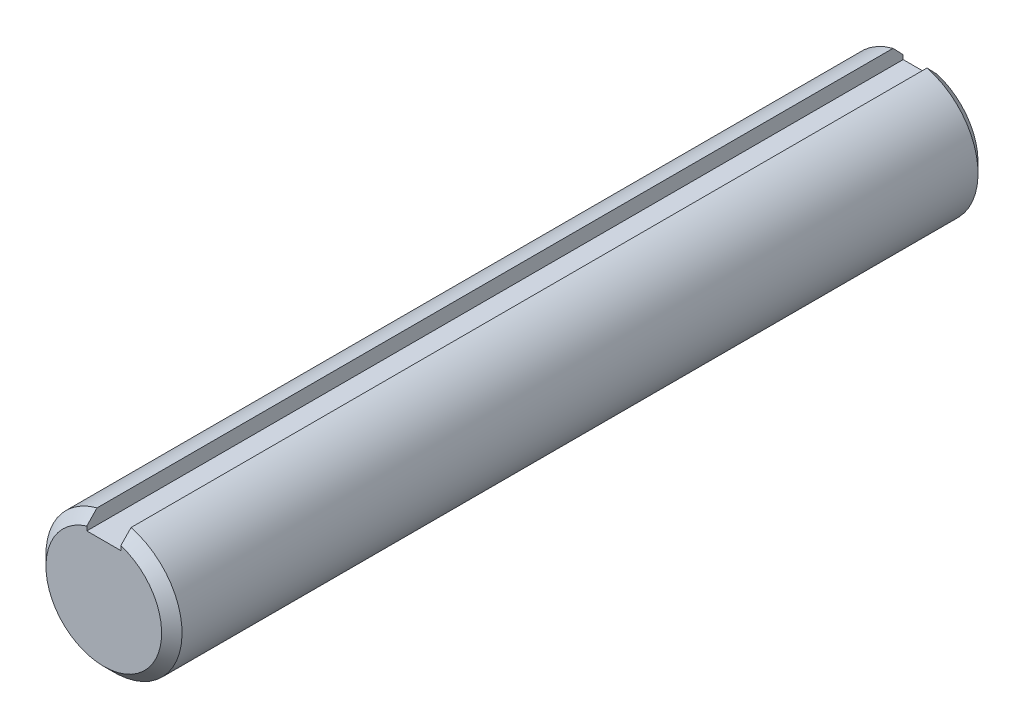
from build123d import *

# Parameters (mm, degrees)
SKETCH1_R           = 12.7
EXTRUDE1_DEPTH      = 76.2
CHAMFER1_SIZE       = 1.905
EXTRUDE2_DEPTH      = 79.288057838
EXTRUDE2_DEPTH_BACK = 79.288057838
SKETCH3_W           = 6.35
SKETCH3_H           = 3.175


with BuildPart() as part:
    # Sketch1 → Extrude1 (new, symmetric)
    with BuildSketch(Plane.XY):
        with Locations(Location((0, 0, 0), (0, 0, 180))):
            Circle(SKETCH1_R)
    extrude(amount=EXTRUDE1_DEPTH, both=True)

    # Chamfer1
    chamfer1_edges = [part.edges().sort_by_distance(p)[0] for p in [
        (12.7, 0, -76.2),
        (12.7, 0, 76.2),
    ]]
    chamfer(chamfer1_edges, length=CHAMFER1_SIZE)

    # Sketch3 → Extrude2 (cut, two sides: drawn at the far end of the back side and taken through both)
    with BuildSketch(Plane.XY.offset(-EXTRUDE2_DEPTH_BACK)):
        with Locations((0, 11.1125)):
            Rectangle(SKETCH3_W, SKETCH3_H)
    extrude(amount=EXTRUDE2_DEPTH + EXTRUDE2_DEPTH_BACK, mode=Mode.SUBTRACT)


solid = part.part
